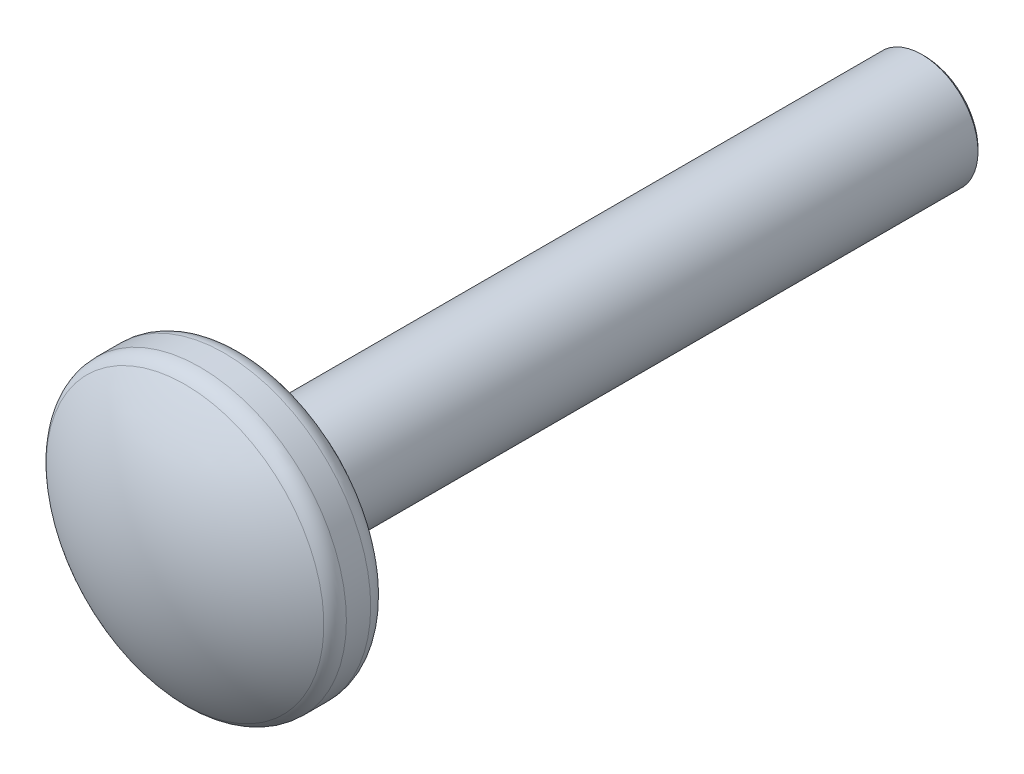
from build123d import *

# Parameters (mm, degrees)
SKETCH3_W           = 19.05
SKETCH3_H           = 1.567244252
SKETCH38_OUTSIDE_W  = 49.402
SKETCH38_OUTSIDE_H  = 49.402
SKETCH38_OUTSIDE_R  = 1.4874875
EXTRUDE6_DEPTH      = 20.178503828
EXTRUDE6_DRAFT      = -45
SKETCH8_W           = 2.921
SKETCH8_H           = 4.0894
SKETCH21_R          = 2.690784338
SKETCH21_R_2        = 1.567244252
EXTRUDE2_DEPTH      = 0.5842
EXTRUDE3_REACH      = 25.354
EXTRUDE3_END_RADIUS = 2.690784338
SKETCH33_W          = 1.016
SKETCH33_H          = 0.5842


with BuildPart() as part:
    # Sketch3 → Revolve1 (revolve)
    with BuildSketch(Plane(origin=(0, 0, 0), x_dir=(0, 0, -1), z_dir=(1, 0, 0))):
        with Locations((-9.525, 0.783622126)):
            Rectangle(SKETCH3_W, SKETCH3_H)
    revolve(axis=Axis((0, 0, 0), (0, 0, 1)))


with BuildPart() as extrude6_tool:
    # Sketch38 outside → Extrude6 (with draft: the straight prism first)
    with BuildSketch(Plane(origin=(0, 0, 0), x_dir=(-1, 0, 0), z_dir=(0, 0, -1))):
        Rectangle(SKETCH38_OUTSIDE_W, SKETCH38_OUTSIDE_H)
        Circle(SKETCH38_OUTSIDE_R, mode=Mode.SUBTRACT)
    extrude(amount=-EXTRUDE6_DEPTH)
    # Extrude6: the draft: its side faces are tilted about the plane it starts from
    extrude6_sides = [extrude6_tool.faces().sort_by_distance(p)[0] for p in [
        (0, -24.701, 10.089251914),
        (-24.701, 0, 10.089251914),
        (0, 24.701, 10.089251914),
        (24.701, 0, 10.089251914),
        (1.4874875, 0, 10.089251914),
    ]]
    draft(extrude6_sides, Plane(origin=(0, 0, 0), x_dir=(-1, 0, 0), z_dir=(0, 0, -1)), EXTRUDE6_DRAFT)


with BuildPart() as part_1:
    add(part.part)

    # Extrude6: cut by extrude6_tool
    add(extrude6_tool.part, mode=Mode.SUBTRACT)

    # Sketch8 → Revolve2 (revolve)
    with BuildSketch(Plane(origin=(0, 0, 0), x_dir=(0, 0, -1), z_dir=(1, 0, 0)), mode=Mode.PRIVATE) as revolve2_sk:
        with Locations((-20.5105, 2.0447)):
            Rectangle(SKETCH8_W, SKETCH8_H)
    revolve(revolve2_sk.sketch.rotate(Axis((0, 0, 0), (0, 0, 1)), 90), axis=Axis((0, 0, 0), (0, 0, 1)))

    # Sketch11 → Cut-Revolve3 (revolve, cut)
    with BuildSketch(Plane(origin=(0, 0, 0), x_dir=(0, 0, -1), z_dir=(1, 0, 0)), mode=Mode.PRIVATE) as cut_revolve3_sk:
        with BuildLine():
            Line((-20.254906874, 4.0894), (-19.57578, 4.0894))
            ThreePointArc((-19.57578, 4.0894), (-19.203997397, 3.935402603), (-19.05, 3.56362))
            Line((-19.05, 3.56362), (-18.415, 3.56362))
            Line((-18.415, 3.56362), (-18.415, 4.7244))
            Line((-18.415, 4.7244), (-22.606, 4.7244))
            Line((-22.606, 4.7244), (-22.606, 0))
            Line((-22.606, 0), (-21.971, 0))
            ThreePointArc((-21.971, 0), (-21.638470898, 2.045152261), (-20.675141868, 3.87960601))
            ThreePointArc((-20.675141868, 3.87960601), (-20.489753083, 4.034036694), (-20.254906874, 4.0894))
        make_face()
    revolve(cut_revolve3_sk.sketch.rotate(Axis((0, 0, 21.971), (0, 0, -1)), 180), axis=Axis((0, 0, 21.971), (0, 0, -1)), mode=Mode.SUBTRACT)


with BuildPart() as body_2:
    # Sketch21 → Extrude2 (new body)
    with BuildSketch(Plane.XY.offset(18.893869553)):
        Circle(SKETCH21_R)
        Circle(SKETCH21_R_2, mode=Mode.SUBTRACT)
    extrude(amount=-EXTRUDE2_DEPTH)

    # Extrude3: up to this cylinder (the profile starts outside it)
    extrude3_end = Plane(origin=(0, 0, 18.60177), z_dir=(0, 0, 1)) * Cylinder(EXTRUDE3_END_RADIUS, 57.089568677, mode=Mode.PRIVATE)
    # Sketch33 → Extrude3 (add, up to the surface)
    with BuildSketch(Plane(origin=(0, 2.690784338, 0), x_dir=(-1, 0, 0), z_dir=(0, 1, 0)), mode=Mode.PRIVATE) as extrude3_sk1:
        with Locations((0, 18.601769553)):
            Rectangle(SKETCH33_W, SKETCH33_H)
    extrude3_tool1 = extrude(extrude3_sk1.sketch, amount=-EXTRUDE3_REACH, mode=Mode.PRIVATE) - extrude3_end
    add(extrude3_tool1.solids().sort_by_distance((0, 2.690784, 18.60177))[0])
    add(extrude3_tool1.solids().sort_by_distance((0, 2.690784, 18.60177))[1])


solid = Compound([part_1.part, body_2.part])
